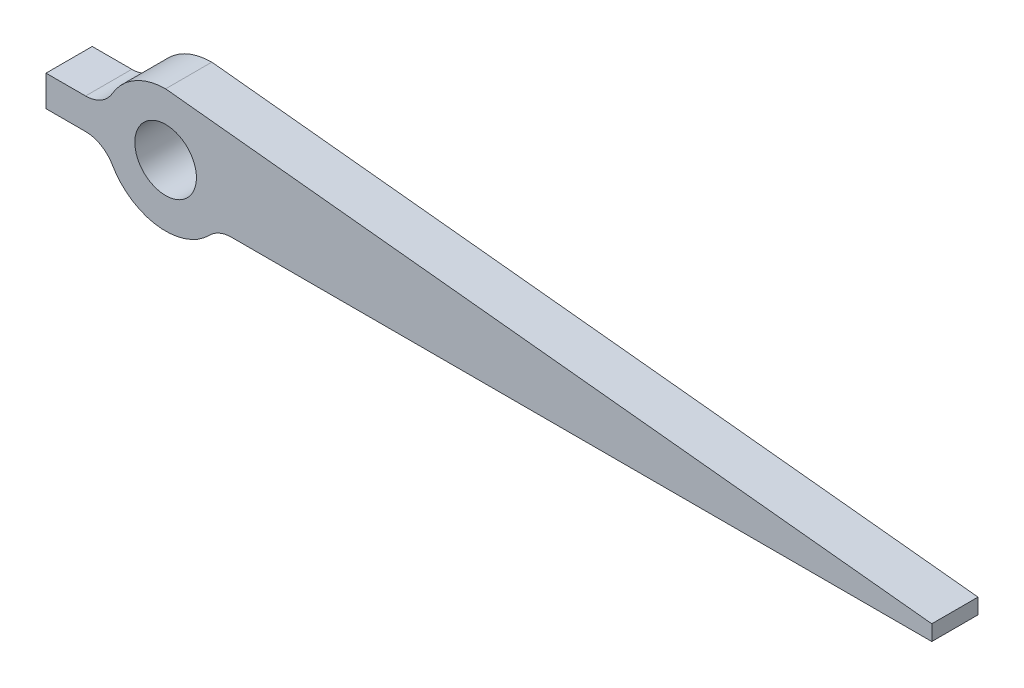
from build123d import *

# Parameters (mm, degrees)
SKETCH1_R           = 1
BOSS_EXTRUDE1_DEPTH = 1.5
FILLET1_R           = 1
FILLET2_R           = 1
FILLET3_R           = 1


with BuildPart() as part:
    # Sketch1 → Boss-Extrude1 (new body)
    with BuildSketch(Plane.XY):
        with BuildLine():
            Line((13.648087548, 15.547724074), (13.648087548, 16.047724074))
            Line((13.648087548, 16.047724074), (-11.216055041, 18.650494389))
            ThreePointArc((-11.216055041, 18.650494389), (-12.440799912, 18.231633219), (-13.152546714, 17.150494389))
            Line((-13.152546714, 17.150494389), (-15.098105849, 17.150494389))
            Line((-15.098105849, 17.150494389), (-15.098105849, 16.150494389))
            Line((-15.098105849, 16.150494389), (-13.152546714, 16.150494389))
            ThreePointArc((-13.152546714, 16.150494389), (-11.545884817, 14.677878786), (-9.547553428, 15.547724074))
            Line((-9.547553428, 15.547724074), (13.648087548, 15.547724074))
        make_face()
        with Locations((-11.216055041, 16.650494389)):
            Circle(SKETCH1_R, mode=Mode.SUBTRACT)
    extrude(amount=BOSS_EXTRUDE1_DEPTH)

    # Fillet1
    fillet1_edges = [part.edges().sort_by_distance(p)[0] for p in [
        (-13.152546714, 16.150494389, 0.75),
    ]]
    fillet(fillet1_edges, radius=FILLET1_R)

    # Fillet2
    fillet2_edges = [part.edges().sort_by_distance(p)[0] for p in [
        (-13.152546714, 17.150494389, 0.75),
    ]]
    fillet(fillet2_edges, radius=FILLET2_R)

    # Fillet3
    fillet3_edges = [part.edges().sort_by_distance(p)[0] for p in [
        (-9.547553428, 15.547724074, 0.75),
    ]]
    fillet(fillet3_edges, radius=FILLET3_R)


solid = part.part
